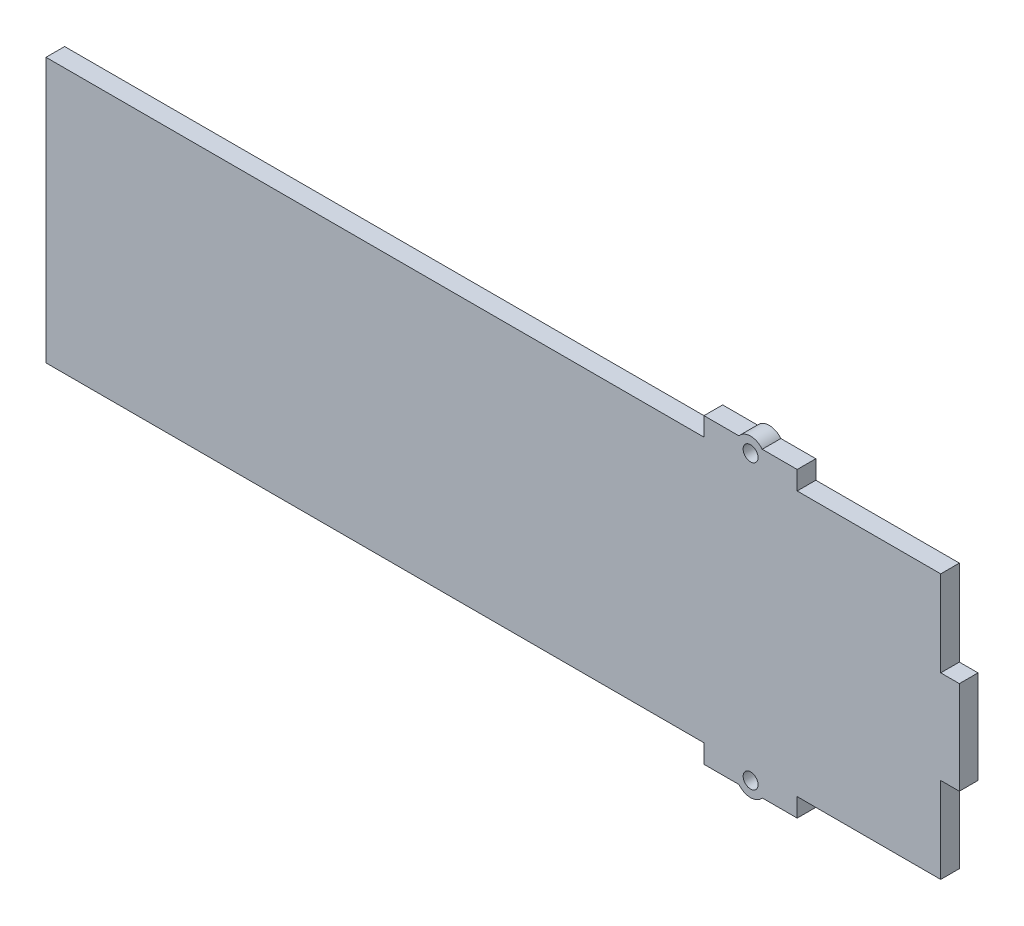
from build123d import *

# Parameters (mm, degrees)
SKETCH1_W           = 102
SKETCH1_H           = 71
BOSS_EXTRUDE1_DEPTH = 5
SKETCH3_W           = 25
SKETCH3_H           = 5
SKETCH3_W_2         = 5
SKETCH3_H_2         = 25
BOSS_EXTRUDE2_DEPTH = 5
SKETCH4_R           = 2
CUT_EXTRUDE1_DEPTH  = 5
SKETCH5_R           = 4
SKETCH5_R_2         = 2
BOSS_EXTRUDE3_DEPTH = 5
SKETCH6_W           = 138
SKETCH6_H           = 71
BOSS_EXTRUDE4_DEPTH = 5


with BuildPart() as part:
    # Sketch1 → Boss-Extrude1 (new body)
    with BuildSketch(Plane.XY):
        Rectangle(SKETCH1_W, SKETCH1_H)
    extrude(amount=BOSS_EXTRUDE1_DEPTH)

    # Sketch3 → Boss-Extrude2 (add)
    with BuildSketch(Plane.XY.offset(5)):
        with Locations((0, 38)):
            Rectangle(SKETCH3_W, SKETCH3_H)
        with Locations((53.5, 0)):
            Rectangle(SKETCH3_W_2, SKETCH3_H_2)
        with Locations((0, -38)):
            Rectangle(SKETCH3_W, SKETCH3_H)
    extrude(amount=-BOSS_EXTRUDE2_DEPTH)

    # Sketch4 → Cut-Extrude1 (cut)
    with BuildSketch(Plane.XY.offset(5)):
        with Locations((0, 38)):
            Circle(SKETCH4_R)
        with Locations((0, -38)):
            Circle(SKETCH4_R)
    extrude(amount=-CUT_EXTRUDE1_DEPTH, mode=Mode.SUBTRACT)

    # Sketch5 → Boss-Extrude3 (add)
    # profile 1 of 2: a face of its own
    with BuildSketch(Plane.XY.offset(5)):
        with Locations((0, 38)):
            Circle(SKETCH5_R)
        with Locations((0, 38)):
            Circle(SKETCH5_R_2, mode=Mode.SUBTRACT)
    # profile 2 of 2: a face of its own
    with BuildSketch(Plane.XY.offset(5)):
        with Locations((0, -38)):
            Circle(SKETCH5_R)
        with Locations((0, -38)):
            Circle(SKETCH5_R_2, mode=Mode.SUBTRACT)
    extrude(amount=-BOSS_EXTRUDE3_DEPTH)

    # Sketch6 → Boss-Extrude4 (add)
    with BuildSketch(Plane.XY.offset(5)):
        with Locations((-120, 0)):
            Rectangle(SKETCH6_W, SKETCH6_H)
    extrude(amount=-BOSS_EXTRUDE4_DEPTH)


solid = part.part
